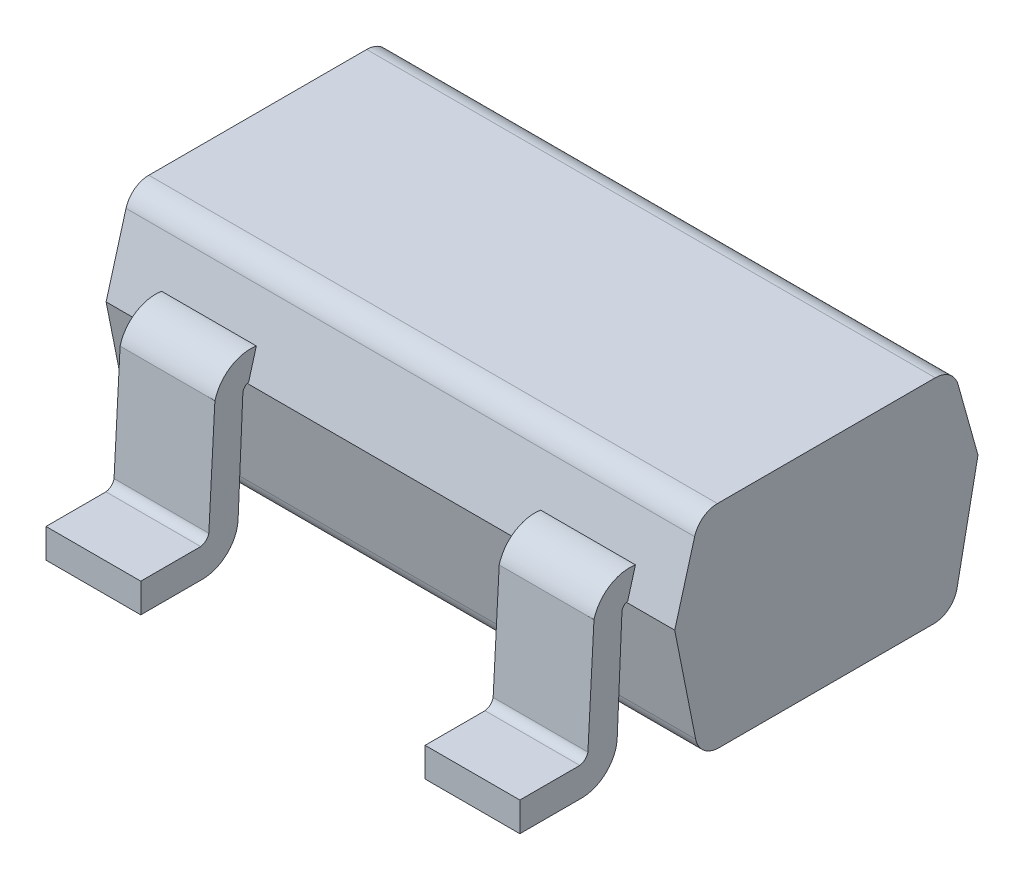
from build123d import *

# Parameters (mm, degrees)
SKETCH1_W           = 3
SKETCH1_H           = 1.6
BOSS_EXTRUDE1_DEPTH = 0.56
CUT_EXTRUDE1_DEPTH  = 4.154932646
BOSS_EXTRUDE2_DEPTH = 0.25
BOSS_EXTRUDE3_DEPTH = 0.25
LPATTERN1_COUNT     = 2
LPATTERN1_PITCH     = 1
LPATTERN1_COL_COUNT = 2
LPATTERN1_COL_PITCH = 1
CUT_EXTRUDE2_DEPTH  = 0.5


with BuildPart() as part:
    # Sketch1 → Boss-Extrude1 (new, symmetric)
    with BuildSketch(Plane(origin=(0, 0, 0), x_dir=(1, 0, 0), z_dir=(0, 1, 0))):
        Rectangle(SKETCH1_W, SKETCH1_H)
    extrude(amount=BOSS_EXTRUDE1_DEPTH, both=True)

    # Sketch3 → Cut-Extrude1 (cut, through all)
    with BuildSketch(Plane(origin=(1.5, 0, 0), x_dir=(0, 0, -1), z_dir=(1, 0, 0))):
        with BuildLine():
            Line((-0.8, 0.094016152), (-0.695023925, 0.468721213))
            ThreePointArc((-0.695023925, 0.468721213), (-0.650189265, 0.534599577), (-0.574658316, 0.56))
            Line((-0.574658316, 0.56), (-0.8, 0.56))
            Line((-0.8, 0.56), (-0.8, 0.094016152))
        make_face()
        with BuildLine():
            ThreePointArc((0.68951869, -0.459468594), (0.646203649, -0.531652921), (0.56693693, -0.56))
            Line((0.56693693, -0.56), (0.8, -0.56))
            Line((0.8, -0.56), (0.8, 0.094016152))
            Line((0.8, 0.094016152), (0.68951869, -0.459468594))
        make_face()
        with BuildLine():
            Line((0.8, 0.56), (0.574658316, 0.56))
            ThreePointArc((0.574658316, 0.56), (0.650189265, 0.534599577), (0.695023925, 0.468721213))
            Line((0.695023925, 0.468721213), (0.8, 0.094016152))
            Line((0.8, 0.094016152), (0.8, 0.56))
        make_face()
        with BuildLine():
            Line((-0.8, 0.094016152), (-0.68951869, -0.459468594))
            ThreePointArc((-0.68951869, -0.459468594), (-0.646203649, -0.531652921), (-0.56693693, -0.56))
            Line((-0.56693693, -0.56), (-0.8, -0.56))
            Line((-0.8, -0.56), (-0.8, 0.094016152))
        make_face()
    extrude(amount=-CUT_EXTRUDE1_DEPTH, mode=Mode.SUBTRACT)

    # Sketch4 → Boss-Extrude2 (add, symmetric)
    with BuildSketch(Plane(origin=(0, 0, 0), x_dir=(0, 0, -1), z_dir=(1, 0, 0))):
        with BuildLine():
            Line((0.976030545, 0.105182979), (1.008085847, -0.484278406))
            ThreePointArc((1.008085847, -0.484278406), (1.023433461, -0.510437852), (1.050826249, -0.523457109))
            Line((1.050826249, -0.523457109), (1.367055221, -0.523457109))
            Line((1.367055221, -0.523457109), (1.367055221, -0.677667296))
            Line((1.367055221, -0.677667296), (1.050826249, -0.677667296))
            ThreePointArc((1.050826249, -0.677667296), (0.910132045, -0.623686799), (0.852912703, -0.484278406))
            Line((0.852912703, -0.484278406), (0.828306269, 0.070433264))
            ThreePointArc((0.828306269, 0.070433264), (0.817908815, 0.090877142), (0.797792626, 0.101895224))
            Line((0.797792626, 0.101895224), (0.757349025, 0.246255946))
            ThreePointArc((0.757349025, 0.246255946), (0.893810861, 0.217760671), (0.976030545, 0.105182979))
        make_face()
    extrude(amount=BOSS_EXTRUDE2_DEPTH, both=True)

    # Sketch5 → Boss-Extrude3 (add, symmetric)
    with BuildSketch(Plane(origin=(0, 0, 0), x_dir=(0, 0, -1), z_dir=(1, 0, 0))):
        with BuildLine():
            Line((-1.008085847, -0.484278406), (-0.976030545, 0.105182979))
            ThreePointArc((-0.976030545, 0.105182979), (-0.893810861, 0.217760671), (-0.757349025, 0.246255946))
            Line((-0.757349025, 0.246255946), (-0.797792626, 0.101895224))
            ThreePointArc((-0.797792626, 0.101895224), (-0.817908815, 0.090877142), (-0.828306269, 0.070433264))
            Line((-0.828306269, 0.070433264), (-0.852912703, -0.484278406))
            ThreePointArc((-0.852912703, -0.484278406), (-0.910132045, -0.623686799), (-1.050826249, -0.677667296))
            Line((-1.050826249, -0.677667296), (-1.367055221, -0.677667296))
            Line((-1.367055221, -0.677667296), (-1.367055221, -0.523457109))
            Line((-1.367055221, -0.523457109), (-1.050826249, -0.523457109))
            ThreePointArc((-1.050826249, -0.523457109), (-1.023433461, -0.510437852), (-1.008085847, -0.484278406))
        make_face()
    boss_extrude3 = extrude(amount=BOSS_EXTRUDE3_DEPTH, both=True)

    # LPattern1: Boss-Extrude3 ×2
    with Locations(*[(i * LPATTERN1_PITCH, 0, 0) for i in range(1, LPATTERN1_COUNT)]):
        add(boss_extrude3)

    # LPattern1 col: Boss-Extrude3 ×2
    with Locations(*[(-i * LPATTERN1_COL_PITCH, 0, 0) for i in range(1, LPATTERN1_COL_COUNT)]):
        add(boss_extrude3)

    # Sketch6 → Cut-Extrude2 (cut)
    with BuildSketch(Plane(origin=(0.25, 0, 0), x_dir=(0, 0, -1), z_dir=(1, 0, 0))):
        with BuildLine():
            Line((-1.050826249, -0.523457109), (-1.367055221, -0.523457109))
            Line((-1.367055221, -0.523457109), (-1.367055221, -0.677667296))
            Line((-1.367055221, -0.677667296), (-1.050826249, -0.677667296))
            ThreePointArc((-1.050826249, -0.677667296), (-0.910132045, -0.623686799), (-0.852912703, -0.484278406))
            Line((-0.852912703, -0.484278406), (-0.828306269, 0.070433264))
            ThreePointArc((-0.828306269, 0.070433264), (-0.817908815, 0.090877142), (-0.797792626, 0.101895224))
            Line((-0.797792626, 0.101895224), (-0.757349025, 0.246255946))
            ThreePointArc((-0.757349025, 0.246255946), (-0.893810861, 0.217760671), (-0.976030545, 0.105182979))
            Line((-0.976030545, 0.105182979), (-1.008085847, -0.484278406))
            ThreePointArc((-1.008085847, -0.484278406), (-1.023433461, -0.510437852), (-1.050826249, -0.523457109))
        make_face()
    extrude(amount=-CUT_EXTRUDE2_DEPTH, mode=Mode.SUBTRACT)


solid = part.part
